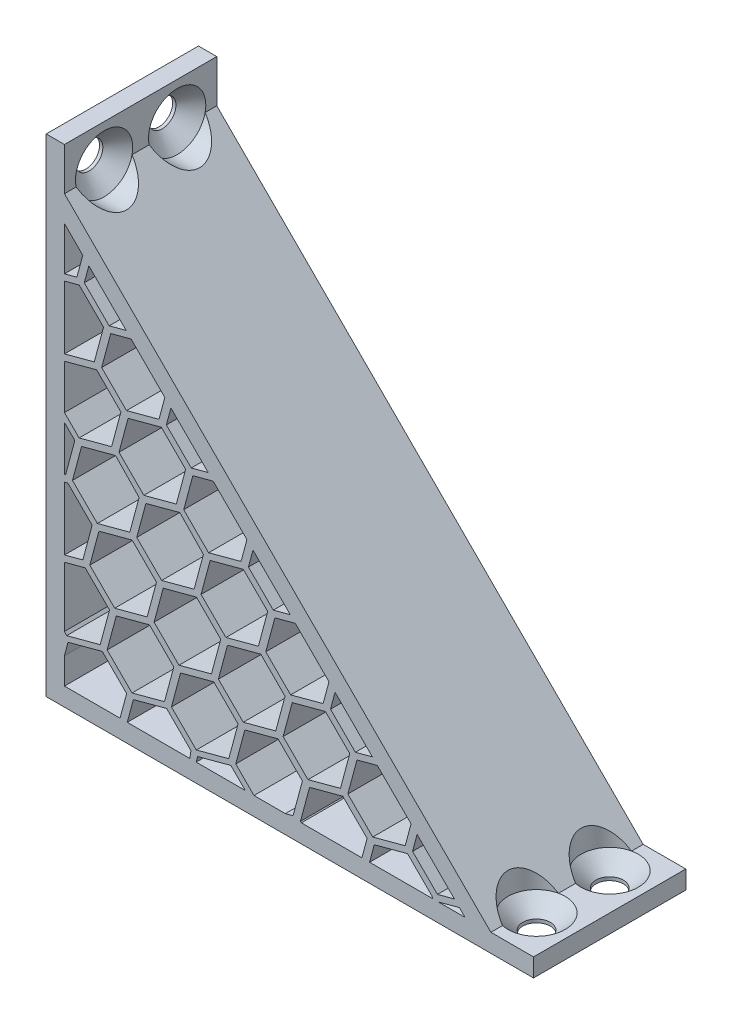
from build123d import *

# Parameters (mm, degrees)
BOSS_EXTRUDE1_DEPTH                          = 25
SKETCH2_R                                    = 2
CUT_EXTRUDE1_DEPTH                           = 114.815640401
CSK_FOR_M4_COUNTERSUNK_FLAT_HEAD_SCR_2_COUNT = 2
CSK_FOR_M4_COUNTERSUNK_FLAT_HEAD_SCR_2_PITCH = 12
SKETCH5_R                                    = 4.7
CUT_EXTRUDE2_DEPTH                           = 114.815640401


with BuildPart() as part:
    # Sketch1 → Boss-Extrude1 (new body)
    with BuildSketch(Plane.XY):
        Polygon((0, 13.930185882), (0, 0), (6.673390787, 0), (13.982046755, 0), (22.628344676, 0), (33.94045303, 0), (49.315813696, 0), (52.665476228, 0), (62.410548055, 0), (73.798586044, 0), (80, 0), (80, 3), (73, 3), (62.196002113, 13.803997887), (56.300874778, 19.699125222), (48.723808517, 27.276191483), (42.82868117, 33.17131883), (35.25161492, 40.74838508), (16.880441848, 59.119558132), (3, 73), (3, 80), (0, 80), (0, 42.576886959), (0, 32.224125087), (0, 21.708360475), (0, 16.521140348), align=None)
        Polygon((3, 68.757359313), (6.006256065, 65.751103248), (5.043923666, 62.159629727), (3, 61.611962031), align=None, mode=Mode.SUBTRACT)
        Polygon((7.002403949, 64.754955363), (13.12612837, 58.631230943), (10.3377407, 57.884084718), (6.25525774, 61.966567663), align=None, mode=Mode.SUBTRACT)
        Polygon((3, 50.223924062), (3, 60.576685831), (5.425446706, 61.226582429), (9.418104027, 57.233925108), (7.890933157, 51.534445654), align=None, mode=Mode.SUBTRACT)
        Polygon((13.942624889, 57.814734424), (19.478449666, 52.278909647), (18.516117273, 48.687436151), (13.184750184, 47.258900642), (9.102267221, 51.341383547), (10.596559631, 56.918158918), align=None, mode=Mode.SUBTRACT)
        Polygon((3, 41.887301628), (3, 49.188647845), (8.272456198, 50.601398356), (12.265113519, 46.608741035), (10.737942649, 40.909261581), (5.406575583, 39.480726079), align=None, mode=Mode.SUBTRACT)
        Polygon((20.47459755, 51.282761762), (26.598321953, 45.15903736), (23.809934276, 44.411891133), (19.727451337, 48.494374044), align=None, mode=Mode.SUBTRACT)
        Polygon((3, 33.141867062), (3, 40.473088065), (4.699468843, 38.773619222), (3.172297974, 33.074139768), align=None, mode=Mode.SUBTRACT)
        Polygon((27.414818477, 44.342540836), (32.950643267, 38.806716046), (31.988310881, 35.215242575), (26.656943732, 33.78670705), (22.574460825, 37.869189957), (24.068753234, 43.445965323), align=None, mode=Mode.SUBTRACT)
        Polygon((3, 21.63993468), (3, 31.992696553), (3.553821019, 32.141092454), (7.546478339, 28.148435133), (6.01930747, 22.448955679), align=None, mode=Mode.SUBTRACT)
        Polygon((33.946791152, 37.810568161), (40.070515536, 31.686843777), (37.282127847, 30.939697547), (33.19964494, 35.022180454), align=None, mode=Mode.SUBTRACT)
        Polygon((3, 10.774603243), (3, 20.604658541), (6.400830515, 21.515908364), (10.393487835, 17.523251044), (8.866316966, 11.82377159), (3.350893578, 10.345918345), align=None, mode=Mode.SUBTRACT)
        Polygon((40.887012074, 30.870347239), (46.422836875, 25.334522438), (45.460504493, 21.743048982), (40.129137344, 20.314513458), (36.046654437, 24.396996365), (37.540946846, 29.973771731), align=None, mode=Mode.SUBTRACT)
        Polygon((3, 3), (3, 7.317043885), (3.571747815, 9.521679096), (9.209875212, 11.032410834), (13.202532532, 7.039753513), (12.120083875, 3), align=None, mode=Mode.SUBTRACT)
        Polygon((47.418984759, 24.338374554), (53.542709132, 18.214650181), (50.754321459, 17.467503954), (46.671838552, 21.549986861), align=None, mode=Mode.SUBTRACT)
        Polygon((23.584051359, 3), (13.307219136, 3), (14.310144817, 6.742969713), (19.764216013, 8.204383739), (23.756873334, 4.211726419), align=None, mode=Mode.SUBTRACT)
        Polygon((54.35920567, 17.398153643), (59.895030483, 11.86232883), (58.932698105, 8.27085539), (53.601330955, 6.842319865), (49.518848048, 10.924802772), (51.013140457, 16.501578138), align=None, mode=Mode.SUBTRACT)
        Polygon((32.694913459, 3), (24.61932749, 3), (24.864485618, 3.914942619), (30.318556814, 5.376356645), align=None, mode=Mode.SUBTRACT)
        Polygon((60.891178367, 10.866180946), (67.014902729, 4.742456584), (64.226515071, 3.995310362), (60.144032164, 8.077793269), align=None, mode=Mode.SUBTRACT)
        Polygon((39.261597887, 3), (34.109127003, 3), (31.115489313, 5.99363769), (32.609781722, 11.570413056), (38.063852918, 13.031827081), (42.056510239, 9.039169761), (40.529339369, 3.339690307), align=None, mode=Mode.SUBTRACT)
        Polygon((67.831399267, 3.925960046), (68.757359313, 3), (64.477460504, 3), (64.485334069, 3.029384546), align=None, mode=Mode.SUBTRACT)
        Polygon((51.826357618, 3), (41.887301615, 3), (41.740673429, 3.146628186), (43.234965838, 8.723403552), (48.689037034, 10.184817578), (52.681694354, 6.192160258), align=None, mode=Mode.SUBTRACT)
        Polygon((63.442184342, 3), (53.089422515, 3), (53.860149954, 5.876394049), (59.31422115, 7.337808075), (63.30687847, 3.345150755), align=None, mode=Mode.SUBTRACT)
        Polygon((13.443569119, 46.292974831), (18.897640314, 47.754388852), (22.890297634, 43.761731532), (21.363126765, 38.062252078), (16.031759675, 36.633716569), (11.949276709, 40.71619946), align=None, mode=Mode.SUBTRACT)
        Polygon((45.842027538, 20.810001667), (49.834684858, 16.817344347), (48.307513989, 11.117864893), (42.97614684, 9.689329368), (38.893663933, 13.771812275), (40.387956342, 19.348587641), align=None, mode=Mode.SUBTRACT)
        Polygon((26.91576273, 32.820781234), (32.369833926, 34.28219526), (36.362491246, 30.289537939), (34.835320377, 24.590058485), (29.503953228, 23.161522961), (25.421470321, 27.244005868), align=None, mode=Mode.SUBTRACT)
        Polygon((16.361421929, 35.648808328), (21.938197325, 37.143100774), (25.808150445, 33.117565034), (24.280979576, 27.41808558), (18.949612427, 25.989550055), (14.86712952, 30.072032962), align=None, mode=Mode.SUBTRACT)
        Polygon((22.055440921, 14.39844015), (27.509512117, 15.859854176), (31.502169437, 11.867196855), (29.974998568, 6.167717401), (24.643631419, 4.739181877), (20.561148512, 8.821664784), align=None, mode=Mode.SUBTRACT)
        Polygon((11.50110012, 17.226467244), (16.955171316, 18.68788127), (20.947828636, 14.69522395), (19.420657767, 8.995744496), (14.089290618, 7.567208971), (10.006807711, 11.649691878), align=None, mode=Mode.SUBTRACT)
        Polygon((8.654090624, 27.851651333), (14.10816182, 29.313065359), (18.10081914, 25.320408039), (16.573648271, 19.620928585), (11.242281122, 18.19239306), (7.159798215, 22.274875967), align=None, mode=Mode.SUBTRACT)
        Polygon((11.383856517, 39.971127867), (15.253809644, 35.945592128), (13.726638775, 30.246112674), (8.395271626, 28.817577149), (4.312788719, 32.900060056), (5.807081128, 38.476835422), align=None, mode=Mode.SUBTRACT)
        Polygon((19.208431425, 25.023624239), (24.662502621, 26.485038265), (28.655159941, 22.492380945), (27.127989072, 16.792901491), (21.796621923, 15.364365966), (17.714139016, 19.446848873), align=None, mode=Mode.SUBTRACT)
        Polygon((29.762772226, 22.195597145), (35.216843422, 23.657011171), (39.209500742, 19.66435385), (37.682329873, 13.964874396), (32.350962724, 12.536338872), (28.268479817, 16.618821779), align=None, mode=Mode.SUBTRACT)
    extrude(amount=BOSS_EXTRUDE1_DEPTH)

    # Sketch2 → Cut-Extrude1 (cut, through all)
    with BuildSketch(Plane(origin=(3, 0, 0), x_dir=(0, 0, -1), z_dir=(1, 0, 0))):
        with Locations(Location((-18.5, 74, 0), (0, 0, 90))):
            Circle(SKETCH2_R)
        with Locations(Location((-6.5, 74, 0), (0, 0, 90))):
            Circle(SKETCH2_R)
    cut_extrude1 = extrude(amount=-CUT_EXTRUDE1_DEPTH, mode=Mode.SUBTRACT)

    # Sketch4 → CSK for M4 Countersunk Flat Head Screw1 (revolve, cut)
    with BuildSketch(Plane(origin=(3, 74, 18.5), x_dir=(0, 0, -1), z_dir=(0, 1, 0))):
        Polygon((0, 0), (0, 3), (2.25, 3), (2.25, 2.45), (4.7, 0), align=None)
    csk_for_m4_countersunk_flat_head_screw1 = revolve(axis=Axis((9.35, 74, 18.5), (-1, 0, 0)), mode=Mode.SUBTRACT)

    # CSK for M4 Countersunk Flat Head Scr 2: CSK for M4 Countersunk Flat Head Screw1 ×2
    with Locations(*[(0, 0, -i * CSK_FOR_M4_COUNTERSUNK_FLAT_HEAD_SCR_2_PITCH) for i in range(1, CSK_FOR_M4_COUNTERSUNK_FLAT_HEAD_SCR_2_COUNT)]):
        add(csk_for_m4_countersunk_flat_head_screw1, mode=Mode.SUBTRACT)

    # Sketch5 → Cut-Extrude2 (cut, through all)
    with BuildSketch(Plane(origin=(3, 0, 0), x_dir=(0, 0, -1), z_dir=(1, 0, 0))):
        with Locations((-18.5, 74)):
            Circle(SKETCH5_R)
        with Locations((-6.5, 74)):
            Circle(SKETCH5_R)
    cut_extrude2 = extrude(amount=CUT_EXTRUDE2_DEPTH, mode=Mode.SUBTRACT)

    # Mirror1: Cut-Extrude1, CSK for M4 Countersunk Flat Head Screw1, Cut-Extrude2 across plane
    add(cut_extrude1.mirror(Plane(origin=(0, 0, 0), x_dir=(0, 0, 1), z_dir=(0.7071067811865437, -0.7071067811865513, 0))), mode=Mode.SUBTRACT)
    add(csk_for_m4_countersunk_flat_head_screw1.mirror(Plane(origin=(0, 0, 0), x_dir=(0, 0, 1), z_dir=(0.7071067811865437, -0.7071067811865513, 0))), mode=Mode.SUBTRACT)
    add(cut_extrude2.mirror(Plane(origin=(0, 0, 0), x_dir=(0, 0, 1), z_dir=(0.7071067811865437, -0.7071067811865513, 0))), mode=Mode.SUBTRACT)

    # Mirror1 copy 1 sketch → Mirror1 copy 1 (revolve, cut)
    with BuildSketch(Plane(origin=(74, 3, 6.5), x_dir=(0, 0, -1), z_dir=(1, 0, 0))):
        Polygon((0, 0), (0, -3), (2.25, -3), (2.25, -2.45), (4.7, 0), align=None)
    revolve(axis=Axis((74, 9.35, 6.5), (0, 1, 0)), mode=Mode.SUBTRACT)


solid = part.part
